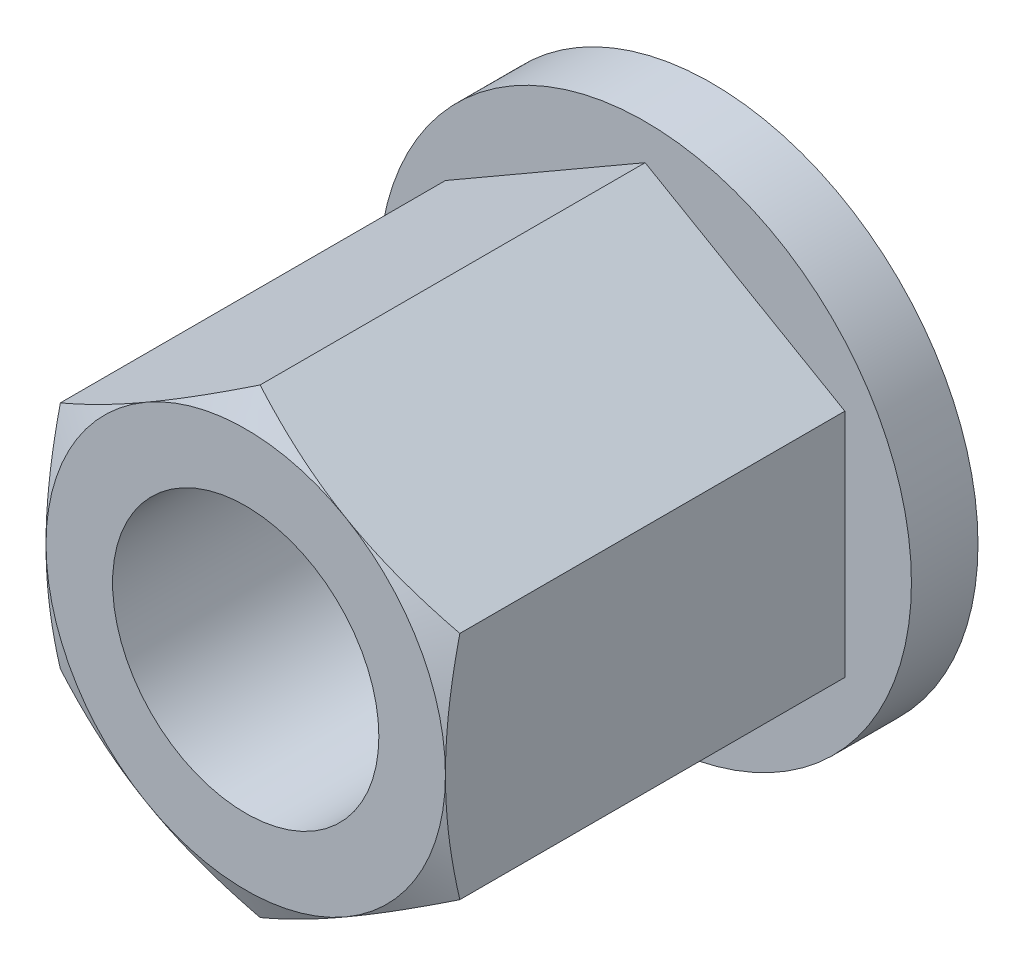
from build123d import *

# Parameters (mm, degrees)
CUT_HEX_START     = 3.175
SKETCH2_OUTSIDE_W = 35.848
SKETCH2_OUTSIDE_H = 35.848
CUT_HEX_DEPTH     = 26.4


with BuildPart() as part:
    # Sketch1 → Revolve1 (revolve)
    with BuildSketch(Plane(origin=(0, 0, 0), x_dir=(0, 0, -1), z_dir=(1, 0, 0))):
        Polygon((-20.744473185, 12.7), (0, 12.7), (0, 6.35), (-22.225, 6.35), (-22.225, 9.525), align=None)
    revolve(axis=Axis((0, 0, 34.597150245), (0, 0, -1)))

    # Sketch2 outside → Cut-HEX (cut, through all)
    with BuildSketch(Plane.XY.offset(CUT_HEX_START)):
        Rectangle(SKETCH2_OUTSIDE_W, SKETCH2_OUTSIDE_H)
        Polygon((9.525, -5.499261314), (9.525, 5.499261314), (0, 10.998522628), (-9.525, 5.499261314), (-9.525, -5.499261314), (0, -10.998522628), align=None, mode=Mode.SUBTRACT)
    extrude(amount=CUT_HEX_DEPTH, mode=Mode.SUBTRACT)


solid = part.part
